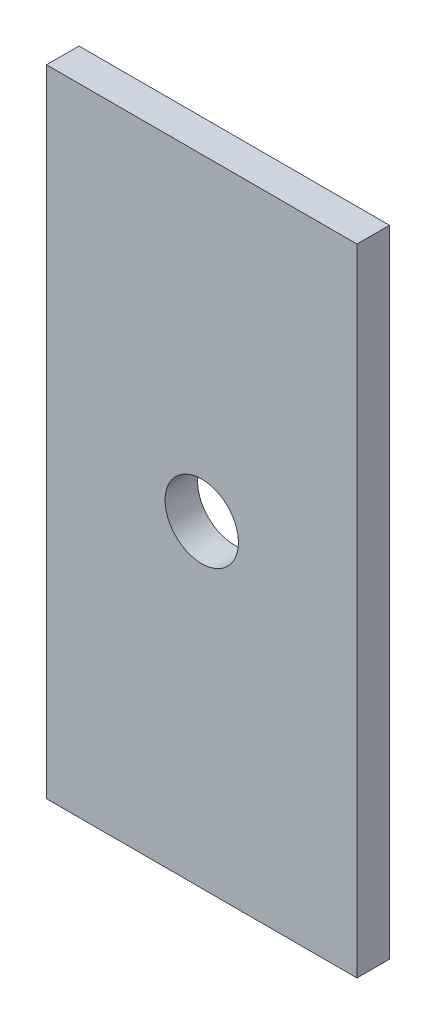
from build123d import *

# Parameters (mm, degrees)
SKETCH1_W           = 25.4
SKETCH1_H           = 52
BOSS_EXTRUDE1_DEPTH = 2.66
SKETCH2_R           = 3
CUT_EXTRUDE1_DEPTH  = 10


with BuildPart() as part:
    # Sketch1 → Boss-Extrude1 (new body)
    with BuildSketch(Plane.XY):
        with Locations((12.7, 26)):
            Rectangle(SKETCH1_W, SKETCH1_H)
    extrude(amount=BOSS_EXTRUDE1_DEPTH)

    # Sketch2 → Cut-Extrude1 (cut)
    with BuildSketch(Plane(origin=(0, 0, 0), x_dir=(-1, 0, 0), z_dir=(0, 0, -1))):
        with Locations((-12.7, 26)):
            Circle(SKETCH2_R)
    extrude(amount=-CUT_EXTRUDE1_DEPTH, mode=Mode.SUBTRACT)


solid = part.part
